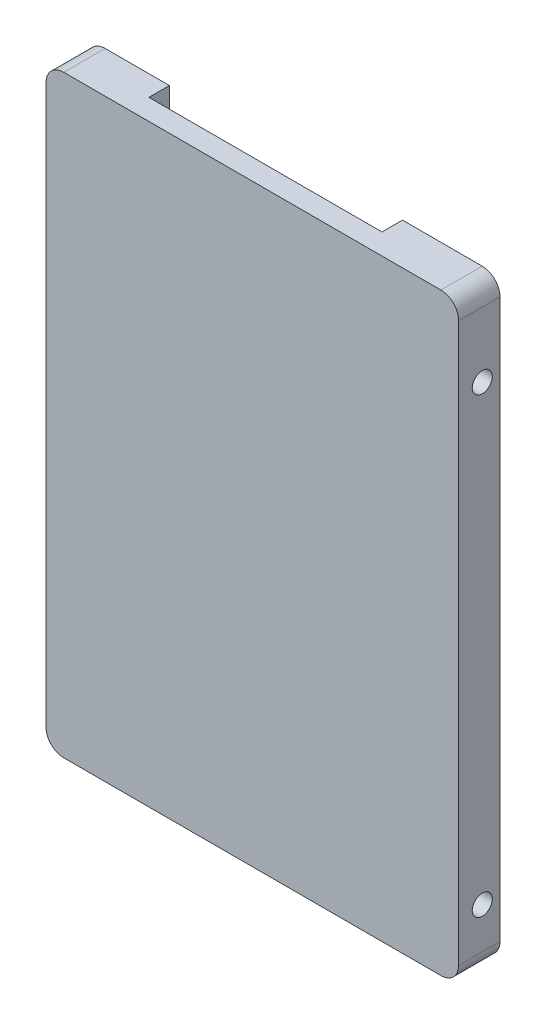
from build123d import *

# Parameters (mm, degrees)
SKETCH1_W                = 69.85
SKETCH1_H                = 100.5
BOSS_EXTRUDE1_DEPTH      = 7
FILLET1_R                = 3
M3_CLEARANCE_HOLE1_D     = 3.4
M3_CLEARANCE_HOLE1_DEPTH = 2
M3_CLEARANCE_HOLE1_TIP   = 1.021463052
M3_CLEARANCE_HOLE2_D     = 3.4
SKETCH6_W                = 39.454447737
SKETCH6_H                = 3.466414688
CUT_EXTRUDE1_DEPTH       = 5


with BuildPart() as part:
    # Sketch1 → Boss-Extrude1 (new body)
    with BuildSketch(Plane.XY):
        with Locations((34.925, 50.25)):
            Rectangle(SKETCH1_W, SKETCH1_H)
    extrude(amount=BOSS_EXTRUDE1_DEPTH)

    # Fillet1
    fillet1_edges = [part.edges().sort_by_distance(p)[0] for p in [
        (0, 100.5, 3.5),
        (69.85, 100.5, 3.5),
        (69.85, 0, 3.5),
        (0, 0, 3.5),
    ]]
    fillet(fillet1_edges, radius=FILLET1_R)

    # M3 Clearance Hole1
    with Locations(Plane(origin=(4.07, 86.5, 0), x_dir=(-1, 0, 0), z_dir=(0, 0, -1))):
        with Locations((0, 0), (-61.71, 0), (-61.71, -76.6), (0, -76.6)):
            Hole(M3_CLEARANCE_HOLE1_D / 2, depth=M3_CLEARANCE_HOLE1_DEPTH)
            with Locations((0, 0, -(M3_CLEARANCE_HOLE1_DEPTH + M3_CLEARANCE_HOLE1_TIP / 2))):  # 118° drill point
                Cone(0, M3_CLEARANCE_HOLE1_D / 2, M3_CLEARANCE_HOLE1_TIP, mode=Mode.SUBTRACT)

    # M3 Clearance Hole2 (through all)
    with Locations(Plane(origin=(0, 86.5, 3), x_dir=(0, 0, -1), z_dir=(-1, 0, 0))):
        with Locations((0, 0), (0, 76.6)):
            Hole(M3_CLEARANCE_HOLE2_D / 2)

    # Sketch6 → Cut-Extrude1 (cut)
    with BuildSketch(Plane(origin=(0, 100.5, 0), x_dir=(1, 0, 0), z_dir=(0, 1, 0))):
        with Locations((33.611063607, -1.733207344)):
            Rectangle(SKETCH6_W, SKETCH6_H)
    extrude(amount=-CUT_EXTRUDE1_DEPTH, mode=Mode.SUBTRACT)


solid = part.part
